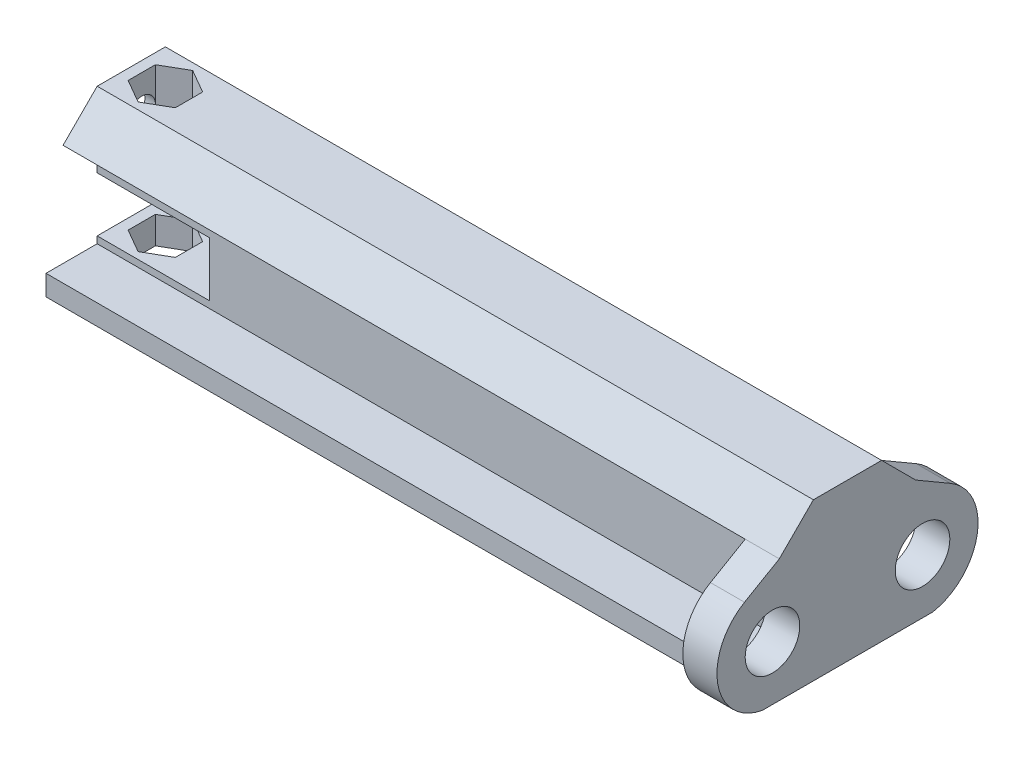
from build123d import *

# Parameters (mm, degrees)
BOSS_EXTRUDE1_DEPTH     = 50
SKETCH2_R               = 12.5
CUT_EXTRUDE1_DEPTH      = 4
CUT_EXTRUDE3_DEPTH      = 54.677276384
CUT_EXTRUDE3_DEPTH_BACK = 54.677276384
SKETCH6_R               = 2
CUT_EXTRUDE4_DEPTH      = 4
SKETCH7_R               = 4
BOSS_EXTRUDE3_DEPTH     = 5


with BuildPart() as part:
    # Sketch1 → Boss-Extrude1 (new, symmetric)
    with BuildSketch(Plane(origin=(0, 0, 0), x_dir=(0, 0, -1), z_dir=(1, 0, 0))):
        Polygon((5, 5), (10, 10), (5, 15), (-5, 15), (-10, 10), (-5, 5), (-5, -5), (-12.5, -5), (-12.5, -8), (12.5, -8), (12.5, -5), (5, -5), align=None)
    extrude(amount=BOSS_EXTRUDE1_DEPTH, both=True)

    # Sketch2 → Cut-Extrude1 (cut, symmetric)
    with BuildSketch(Plane(origin=(0, 0, 0), x_dir=(1, 0, 0), z_dir=(0, 1, 0))):
        with Locations((-45, 0)):
            Circle(SKETCH2_R)
    extrude(amount=CUT_EXTRUDE1_DEPTH, both=True, mode=Mode.SUBTRACT)

    # Sketch4 → Cut-Extrude3 (cut, two sides: drawn at the far end of the back side and taken through both)
    with BuildSketch(Plane(origin=(0, 0, 0), x_dir=(1, 0, 0), z_dir=(0, 1, 0)).offset(-CUT_EXTRUDE3_DEPTH_BACK)):
        Polygon((-45, -4), (-41.535898385, -2), (-41.535898385, 2), (-45, 4), (-48.464101615, 2), (-48.464101615, -2), align=None)
    extrude(amount=CUT_EXTRUDE3_DEPTH + CUT_EXTRUDE3_DEPTH_BACK, mode=Mode.SUBTRACT)

    # Sketch6 → Cut-Extrude4 (cut)
    with BuildSketch(Plane.ZY.offset(50)):
        with Locations((0, 10)):
            Circle(SKETCH6_R)
    extrude(amount=-CUT_EXTRUDE4_DEPTH, mode=Mode.SUBTRACT)

    # Sketch7 → Boss-Extrude3 (add)
    with BuildSketch(Plane(origin=(50, 0, 0), x_dir=(0, 0, -1), z_dir=(1, 0, 0))):
        with BuildLine():
            Line((10, 10), (15.094664958, 7.034466496))
            ThreePointArc((15.094664958, 7.034466496), (19.020839401, -1.384245389), (12.5, -8))
            Line((12.5, -8), (-12.5, -8))
            ThreePointArc((-12.5, -8), (-19.020839401, -1.384245389), (-15.094664958, 7.034466496))
            Line((-15.094664958, 7.034466496), (-10, 10))
            Line((-10, 10), (-5, 15))
            Line((-5, 15), (5, 15))
            Line((5, 15), (10, 10))
        make_face()
        with Locations((11, 0)):
            Circle(SKETCH7_R, mode=Mode.SUBTRACT)
        with Locations(Location((-11, 0, 0), (0, 0, 180))):
            Circle(SKETCH7_R, mode=Mode.SUBTRACT)
    extrude(amount=BOSS_EXTRUDE3_DEPTH)


solid = part.part
